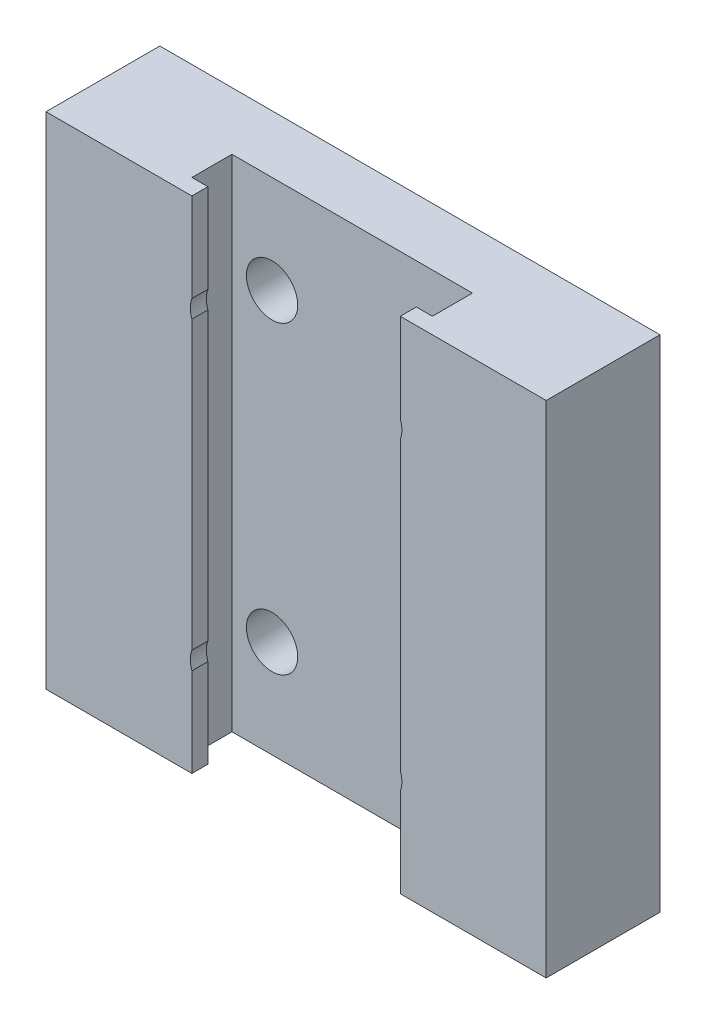
from build123d import *

# Parameters (mm, degrees)
EXTRUDE_1_DEPTH     = 31.2
SKETCH_2_R          = 1.6
CUT_EXTRUDE_1_DEPTH = 10


with BuildPart() as part:
    # 草图1 → 凸台-拉伸1 (new body)
    with BuildSketch(Plane(origin=(0, 0, 0), x_dir=(1, 0, 0), z_dir=(0, 1, 0))):
        Polygon((-7.5, -0.275116875), (-6.5, -0.275116875), (-6.5, -1.275116875), (-15.6, -1.275116875), (-15.6, 5.824883125), (15.6, 5.824883125), (15.6, -1.275116875), (6.5, -1.275116875), (6.5, -0.275116875), (7.5, -0.275116875), (7.5, 2.224883125), (-7.5, 2.224883125), align=None)
    extrude(amount=EXTRUDE_1_DEPTH)

    # 草图2 → 切除-拉伸1 (cut)
    with BuildSketch(Plane(origin=(0, 0, -5.824883125), x_dir=(-1, 0, 0), z_dir=(0, 0, -1))):
        with Locations((-5, 25.1)):
            Circle(SKETCH_2_R)
        with Locations((5, 25.1)):
            Circle(SKETCH_2_R)
        with Locations((5, 6.1)):
            Circle(SKETCH_2_R)
        with Locations((-5, 6.1)):
            Circle(SKETCH_2_R)
    extrude(amount=-CUT_EXTRUDE_1_DEPTH, mode=Mode.SUBTRACT)


solid = part.part
